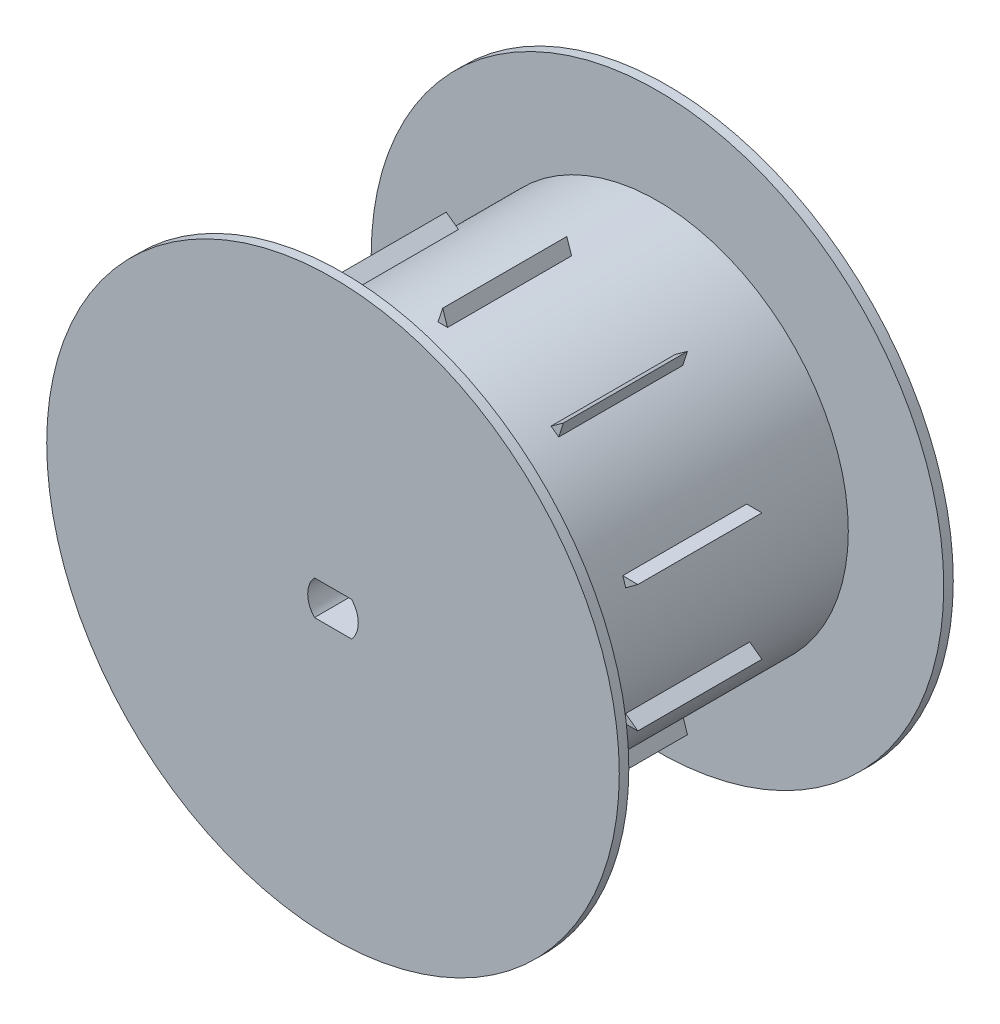
from build123d import *

# Parameters (mm, degrees)
SKETCH_1_R               = 20
EXTRUDE_1_DEPTH          = 35
SKETCH_3_R               = 30
EXTRUDE_2_DEPTH          = 1
EXTRUDE_START            = -1
SKETCH_4_R               = 30
EXTRUDE_3_DEPTH          = 1
CUT_EXTRUDE_2_DEPTH      = 56
CUT_EXTRUDE_2_DEPTH_BACK = 56
SKETCH_5_W               = 1
SKETCH_5_H               = 13
EXTRUDE_4_DEPTH          = 21.5
CUT_EXTRUDE_3_REACH      = 50.5
PATTERN_CIRCULAR_2_COUNT = 10
CUT_EXTRUDE_5_DEPTH      = 56
CUT_EXTRUDE_5_DEPTH_BACK = 56


with BuildPart() as part:
    # Эскиз1 → Бобышка-Вытянуть1 (new body)
    with BuildSketch(Plane.XY):
        Circle(SKETCH_1_R)
    extrude(amount=EXTRUDE_1_DEPTH)

    # Эскиз3 → Бобышка-Вытянуть2 (add)
    with BuildSketch(Plane.XY.offset(35)):
        Circle(SKETCH_3_R)
    extrude(amount=-EXTRUDE_2_DEPTH)

    # Эскиз4 → Бобышка-Вытянуть3 (add)
    with BuildSketch(Plane(origin=(0, 0, 0), x_dir=(-1, 0, 0), z_dir=(0, 0, -1)).offset(EXTRUDE_START)):
        with Locations(Location((0, 0, 0), (0, 0, 180))):
            Circle(SKETCH_4_R)
    extrude(amount=EXTRUDE_3_DEPTH)

    # Эскиз2 → Вырез-Вытянуть2 (cut, two sides: drawn at the far end of the back side and taken through both)
    with BuildSketch(Plane.XY.offset(35).offset(-CUT_EXTRUDE_2_DEPTH_BACK)):
        with BuildLine():
            Line((-1.944865034, 1.8), (1.944865034, 1.8))
            ThreePointArc((1.944865034, 1.8), (2.65, 0), (1.944865034, -1.8))
            Line((1.944865034, -1.8), (-1.944865034, -1.8))
            ThreePointArc((-1.944865034, -1.8), (-2.65, 0), (-1.944865034, 1.8))
        make_face()
    extrude(amount=CUT_EXTRUDE_2_DEPTH + CUT_EXTRUDE_2_DEPTH_BACK, mode=Mode.SUBTRACT)

    # Эскиз5 → Бобышка-Вытянуть4 (add)
    with BuildSketch(Plane(origin=(0, 0, 0), x_dir=(1, 0, 0), z_dir=(0, 1, 0))):
        with Locations((0, -17)):
            Rectangle(SKETCH_5_W, SKETCH_5_H)
    extrude_4 = extrude(amount=EXTRUDE_4_DEPTH)

    # Эскиз6 → Вырез-Вытянуть3 (cut, up to next)
    with BuildSketch(Plane.XY.offset(23.5), mode=Mode.PRIVATE) as cut_extrude_3_sk1:
        Polygon((-0.5, 19.993749023), (0, 21.5), (-0.5, 21.5), align=None)
    cut_extrude_3_tool1 = extrude(cut_extrude_3_sk1.sketch, amount=-CUT_EXTRUDE_3_REACH, mode=Mode.PRIVATE) & part.part
    # Эскиз6 → Вырез-Вытянуть3 (cut, up to next)
    with BuildSketch(Plane.XY.offset(23.5), mode=Mode.PRIVATE) as cut_extrude_3_sk2:
        Polygon((0.5, 21.5), (0, 21.5), (0.5, 19.993749023), align=None)
    cut_extrude_3_tool2 = extrude(cut_extrude_3_sk2.sketch, amount=-CUT_EXTRUDE_3_REACH, mode=Mode.PRIVATE) & part.part
    cut_extrude_3_1 = cut_extrude_3_tool1.solids().sort_by_distance((-0.333333, 20.997916, 23.5))[0]
    add(cut_extrude_3_1, mode=Mode.SUBTRACT)
    cut_extrude_3_2 = cut_extrude_3_tool2.solids().sort_by_distance((0.333333, 20.997916, 23.5))[0]
    add(cut_extrude_3_2, mode=Mode.SUBTRACT)
    cut_extrude_3 = cut_extrude_3_1 + cut_extrude_3_2  # Вырез-Вытянуть3 as one shape, for the pattern or mirror that repeats it

    # Круговой массив2: Бобышка-Вытянуть4, Вырез-Вытянуть3 ×10 about axis
    pattern_circular_2_axis = Axis((0, 0, 0), (0, 0, 1))
    add([extrude_4.rotate(pattern_circular_2_axis, i * 360 / PATTERN_CIRCULAR_2_COUNT) for i in range(1, PATTERN_CIRCULAR_2_COUNT)])
    add([cut_extrude_3.rotate(pattern_circular_2_axis, i * 360 / PATTERN_CIRCULAR_2_COUNT) for i in range(1, PATTERN_CIRCULAR_2_COUNT)], mode=Mode.SUBTRACT)

    # Эскиз8 → Вырез-Вытянуть5 (cut, two sides: drawn at the far end of the back side and taken through both)
    with BuildSketch(Plane.XY.offset(35).offset(-CUT_EXTRUDE_5_DEPTH_BACK)):
        with BuildLine():
            ThreePointArc((-1.944865034, -1.8), (-2.65, 0), (-1.944865034, 1.8))
            Line((-1.944865034, 1.8), (1.944865034, 1.8))
            ThreePointArc((1.944865034, 1.8), (2.65, 0), (1.944865034, -1.8))
            Line((1.944865034, -1.8), (-1.944865034, -1.8))
        make_face()
    extrude(amount=CUT_EXTRUDE_5_DEPTH + CUT_EXTRUDE_5_DEPTH_BACK, mode=Mode.SUBTRACT)


solid = part.part
